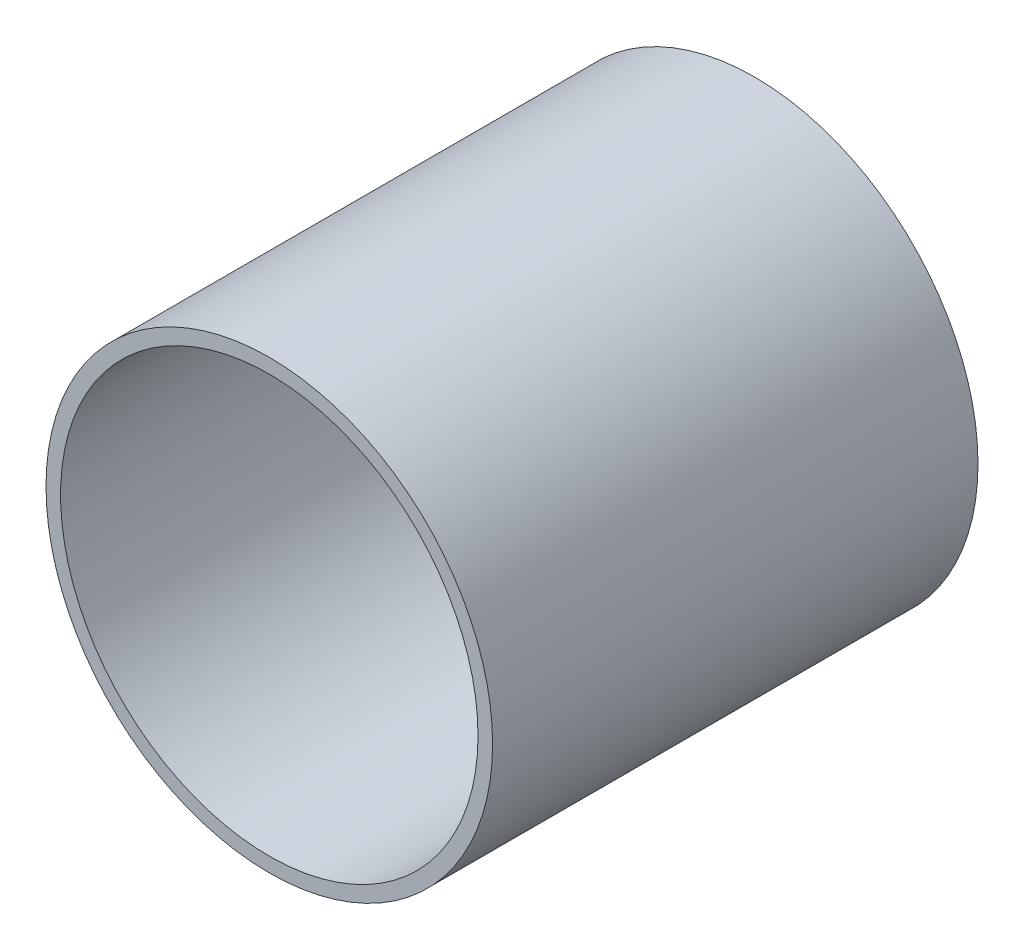
from build123d import *

# Parameters (mm, degrees)
SKETCH_1_R      = 23
SKETCH_1_R_2    = 21.5
EXTRUDE_1_DEPTH = 50


with BuildPart() as part:
    # 草图1 → 凸台-拉伸1 (new body)
    with BuildSketch(Plane.XY):
        Circle(SKETCH_1_R)
        Circle(SKETCH_1_R_2, mode=Mode.SUBTRACT)
    extrude(amount=EXTRUDE_1_DEPTH)


solid = part.part
